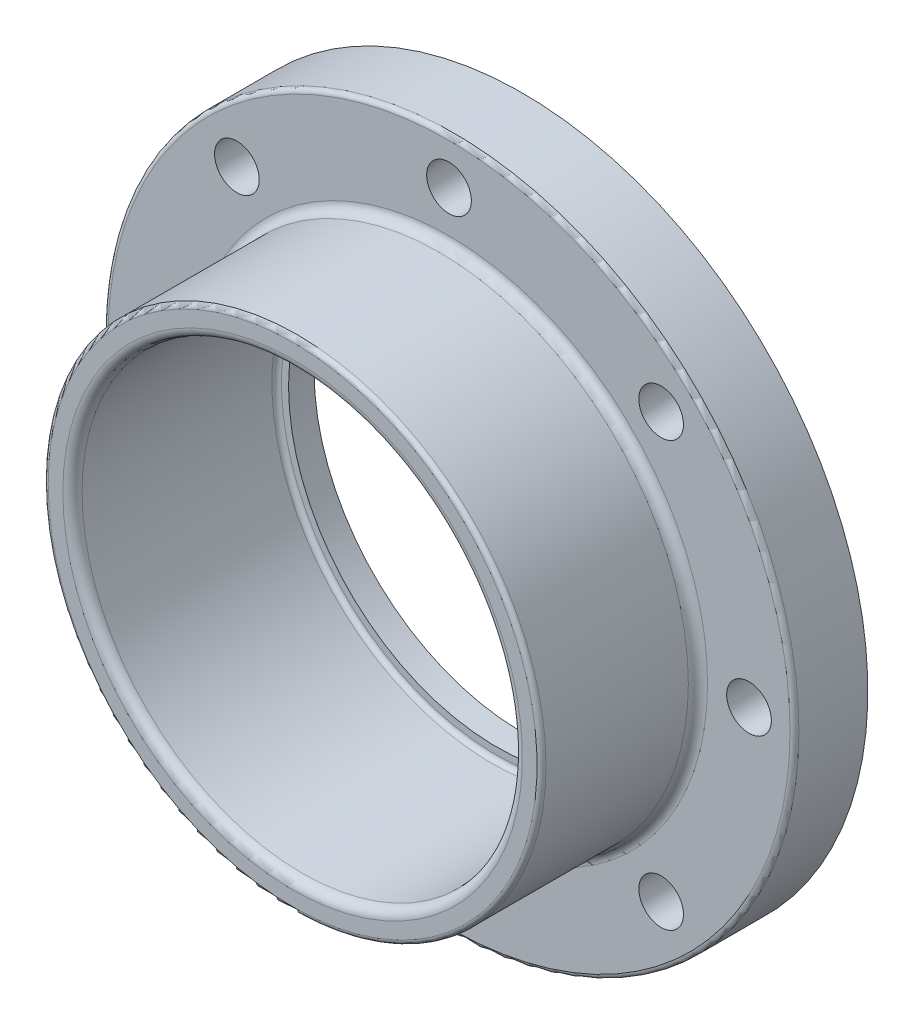
from build123d import *

# Parameters (mm, degrees)
SKETCH8_R                     = 171.846875
SKETCH8_R_2                   = 103.632
BOSS_EXTRUDE3_DEPTH           = 38.1
SKETCH4_R                     = 123.825
SKETCH4_R_2                   = 103.632
BOSS_EXTRUDE2_DEPTH           = 77.7875
SKETCH5_R                     = 109.5375
CUT_EXTRUDE1_DEPTH            = 101.6
FILLET1_R                     = 2.3876
SKETCH6_R                     = 11.1125
CUT_EXTRUDE2_DEPTH            = 256.173650777
CIRPATTERN1_COUNT             = 8
CUT_EXTRUDE3_DEPTH            = 20.6375
FILLET2_R                     = 2.2225
CIRPATTERN2_COUNT             = 8
FILLET2_OF_CIRPATTERN2_R      = 2.2225
FILLET3_R                     = 2.2225
FILLET4_R                     = 4.7752
SKETCH13_R                    = 171.846875
SKETCH13_R_2                  = 134.66445
CUT_EXTRUDE4_DEPTH            = 1.5875
SKETCH12_R                    = 13.6985375
SKETCH12_R_2                  = 11.9745125
BOSS_EXTRUDE4_DEPTH           = 1.5875
BOSS_EXTRUDE4_DRAFT           = 20
BOSS_EXTRUDE4_PROFILE_2_DEPTH = 1.5875
BOSS_EXTRUDE4_PROFILE_2_DRAFT = 20
BOSS_EXTRUDE4_PROFILE_3_DEPTH = 1.5875
BOSS_EXTRUDE4_PROFILE_3_DRAFT = 20
BOSS_EXTRUDE4_PROFILE_4_DEPTH = 1.5875
BOSS_EXTRUDE4_PROFILE_4_DRAFT = 20
BOSS_EXTRUDE4_PROFILE_5_DEPTH = 1.5875
BOSS_EXTRUDE4_PROFILE_5_DRAFT = 20
BOSS_EXTRUDE4_PROFILE_6_DEPTH = 1.5875
BOSS_EXTRUDE4_PROFILE_6_DRAFT = 20
BOSS_EXTRUDE4_PROFILE_7_DEPTH = 1.5875
BOSS_EXTRUDE4_PROFILE_7_DRAFT = 20
BOSS_EXTRUDE4_PROFILE_8_DEPTH = 1.5875
BOSS_EXTRUDE4_PROFILE_8_DRAFT = 20


with BuildPart() as part:
    # Sketch8 → Boss-Extrude3 (new body)
    with BuildSketch(Plane.XY):
        with Locations(Location((0, 0, 0), (0, 0, 180))):
            Circle(SKETCH8_R)
        with Locations(Location((0, 0, 0), (0, 0, 180))):
            Circle(SKETCH8_R_2, mode=Mode.SUBTRACT)
    extrude(amount=BOSS_EXTRUDE3_DEPTH)

    # Sketch4 → Boss-Extrude2 (add)
    with BuildSketch(Plane(origin=(0, 0, 38.1), x_dir=(-1, 0, 0), z_dir=(0, 0, -1))):
        Circle(SKETCH4_R)
        Circle(SKETCH4_R_2, mode=Mode.SUBTRACT)
    extrude(amount=-BOSS_EXTRUDE2_DEPTH)

    # Sketch5 → Cut-Extrude1 (cut)
    with BuildSketch(Plane.XY.offset(115.8875)):
        Circle(SKETCH5_R)
    extrude(amount=-CUT_EXTRUDE1_DEPTH, mode=Mode.SUBTRACT)

    # Fillet1
    fillet1_edges = [part.edges().sort_by_distance(p)[0] for p in [
        (-109.5375, 0, 14.2875),
    ]]
    fillet(fillet1_edges, radius=FILLET1_R)

    # Sketch6 → Cut-Extrude2 (cut, through all)
    with BuildSketch(Plane.XY.offset(38.1)):
        with Locations((0, 149.225)):
            Circle(SKETCH6_R)
    cut_extrude2 = extrude(amount=-CUT_EXTRUDE2_DEPTH, mode=Mode.SUBTRACT)

    # CirPattern1: Cut-Extrude2 ×8 about axis
    cirpattern1_axis = Axis((0, 0, 0), (0, 0, 1))
    for i in range(1, CIRPATTERN1_COUNT):
        add(cut_extrude2.rotate(cirpattern1_axis, i * 360 / CIRPATTERN1_COUNT), mode=Mode.SUBTRACT)

    # Sketch7 → Cut-Extrude3 (cut)
    with BuildSketch(Plane(origin=(0, 0, 0), x_dir=(-1, 0, 0), z_dir=(0, 0, -1))):
        with BuildLine():
            ThreePointArc((-49.547012336, 152.490024181), (-61.358504837, 148.132534544), (-72.791701752, 142.861758572))
            ThreePointArc((-72.791701752, 142.861758572), (-77.648042324, 127.915479144), (-62.701762895, 123.059138572))
            ThreePointArc((-62.701762895, 123.059138572), (-52.853365553, 127.599311934), (-42.679109636, 131.352793107))
            ThreePointArc((-42.679109636, 131.352793107), (-35.544445448, 145.355359994), (-49.547012336, 152.490024181))
        make_face()
    cut_extrude3 = extrude(amount=-CUT_EXTRUDE3_DEPTH, mode=Mode.SUBTRACT)

    # Fillet2
    fillet2_edges = [part.edges().sort_by_distance(p)[0] for p in [
        (35.544445448, 145.355359994, 20.6375),
        (52.853365553, 127.599311934, 20.6375),
        (77.648042324, 127.915479144, 20.6375),
        (61.358504837, 148.132534544, 20.6375),
    ]]
    fillet(fillet2_edges, radius=FILLET2_R)

    # CirPattern2: Cut-Extrude3 ×8 about axis
    cirpattern2_axis = Axis((0, 0, 0), (0, 0, 1))
    for i in range(1, CIRPATTERN2_COUNT):
        add(cut_extrude3.rotate(cirpattern2_axis, i * 360 / CIRPATTERN2_COUNT), mode=Mode.SUBTRACT)

    # Fillet2 of CirPattern2
    fillet2_of_cirpattern2_edges = [part.edges().sort_by_distance(p)[0] for p in [
        (-77.648042324, 127.915479144, 20.6375),
        (-52.853365553, 127.599311934, 20.6375),
        (-35.544445448, 145.355359994, 20.6375),
        (-61.358504837, 148.132534544, 20.6375),
        (-145.355359994, 35.544445448, 20.6375),
        (-127.599311934, 52.853365553, 20.6375),
        (-127.915479144, 77.648042324, 20.6375),
        (-148.132534544, 61.358504837, 20.6375),
        (-127.915479144, -77.648042324, 20.6375),
        (-127.599311934, -52.853365553, 20.6375),
        (-145.355359994, -35.544445448, 20.6375),
        (-148.132534544, -61.358504837, 20.6375),
        (-35.544445448, -145.355359994, 20.6375),
        (-52.853365553, -127.599311934, 20.6375),
        (-77.648042324, -127.915479144, 20.6375),
        (-61.358504837, -148.132534544, 20.6375),
        (77.648042324, -127.915479144, 20.6375),
        (52.853365553, -127.599311934, 20.6375),
        (35.544445448, -145.355359994, 20.6375),
        (61.358504837, -148.132534544, 20.6375),
        (145.355359994, -35.544445448, 20.6375),
        (127.599311934, -52.853365553, 20.6375),
        (127.915479144, -77.648042324, 20.6375),
        (148.132534544, -61.358504837, 20.6375),
        (127.915479144, 77.648042324, 20.6375),
        (127.599311934, 52.853365553, 20.6375),
        (145.355359994, 35.544445448, 20.6375),
        (148.132534544, 61.358504837, 20.6375),
    ]]
    fillet(fillet2_of_cirpattern2_edges, radius=FILLET2_OF_CIRPATTERN2_R)

    # Fillet3
    fillet3_edges = [part.edges().sort_by_distance(p)[0] for p in [
        (123.825, 0, 115.8875),
        (171.846875, 0, 38.1),
    ]]
    fillet(fillet3_edges, radius=FILLET3_R)

    # Fillet4
    fillet4_edges = [part.edges().sort_by_distance(p)[0] for p in [
        (-109.5375, 0, 115.8875),
        (123.825, 0, 38.1),
    ]]
    fillet(fillet4_edges, radius=FILLET4_R)

    # Sketch10 → Cut-Revolve1 (revolve, cut)
    with BuildSketch(Plane(origin=(0, 0, 0), x_dir=(0, 0, -1), z_dir=(1, 0, 0))):
        Polygon((-1.5875, 134.66445), (1.86055, 134.66445), (1.86055, 103.632), (-1.5875, 103.632), (-1.5875, 110.5281), (0, 113.97615), (0, 131.2164), align=None)
    revolve(axis=Axis((0, 0, 0), (0, 0, 1)), mode=Mode.SUBTRACT)

    # Sketch13 → Cut-Extrude4 (cut)
    with BuildSketch(Plane(origin=(0, 0, 0), x_dir=(-1, 0, 0), z_dir=(0, 0, -1))):
        Circle(SKETCH13_R)
        Circle(SKETCH13_R_2, mode=Mode.SUBTRACT)
    extrude(amount=-CUT_EXTRUDE4_DEPTH, mode=Mode.SUBTRACT)


with BuildPart() as boss_extrude4_tool:
    # Sketch12 → Boss-Extrude4 (with draft: the straight prism first)
    with BuildSketch(Plane(origin=(0, 0, 1.5875), x_dir=(-1, 0, 0), z_dir=(0, 0, -1))):
        with Locations((0, 149.225)):
            Circle(SKETCH12_R)
        with Locations((0, 149.225)):
            Circle(SKETCH12_R_2, mode=Mode.SUBTRACT)
    extrude(amount=BOSS_EXTRUDE4_DEPTH)
    # Boss-Extrude4: the draft: its side faces are tilted about the plane it starts from
    boss_extrude4_sides = [boss_extrude4_tool.faces().sort_by_distance(p)[0] for p in [
        (13.6985375, 149.225, 0.79375),
        (11.9745125, 149.225, 0.79375),
    ]]
    draft(boss_extrude4_sides, Plane(origin=(0, 0, 1.5875), x_dir=(-1, 0, 0), z_dir=(0, 0, -1)), BOSS_EXTRUDE4_DRAFT)


with BuildPart() as part_1:
    add(part.part)

    # Boss-Extrude4: add boss_extrude4_tool
    add(boss_extrude4_tool.part)


with BuildPart() as boss_extrude4_profile_2_tool:
    # Sketch12 → Boss-Extrude4 profile 2 (with draft: the straight prism first)
    with BuildSketch(Plane(origin=(0, 0, 1.5875), x_dir=(-1, 0, 0), z_dir=(0, 0, -1))):
        with Locations((-105.518009423, 105.518009423)):
            Circle(SKETCH12_R)
        with Locations((-105.518009423, 105.518009423)):
            Circle(SKETCH12_R_2, mode=Mode.SUBTRACT)
    extrude(amount=BOSS_EXTRUDE4_PROFILE_2_DEPTH)
    # Boss-Extrude4 profile 2: the draft: its side faces are tilted about the plane it starts from
    boss_extrude4_profile_2_sides = [boss_extrude4_profile_2_tool.faces().sort_by_distance(p)[0] for p in [
        (119.216546923, 105.518009423, 0.79375),
        (117.492521923, 105.518009423, 0.79375),
    ]]
    draft(boss_extrude4_profile_2_sides, Plane(origin=(0, 0, 1.5875), x_dir=(-1, 0, 0), z_dir=(0, 0, -1)), BOSS_EXTRUDE4_PROFILE_2_DRAFT)


with BuildPart() as part_2:
    add(part_1.part)

    # Boss-Extrude4 profile 2: add boss_extrude4_profile_2_tool
    add(boss_extrude4_profile_2_tool.part)


with BuildPart() as boss_extrude4_profile_3_tool:
    # Sketch12 → Boss-Extrude4 profile 3 (with draft: the straight prism first)
    with BuildSketch(Plane(origin=(0, 0, 1.5875), x_dir=(-1, 0, 0), z_dir=(0, 0, -1))):
        with Locations((-149.225, 0)):
            Circle(SKETCH12_R)
        with Locations((-149.225, 0)):
            Circle(SKETCH12_R_2, mode=Mode.SUBTRACT)
    extrude(amount=BOSS_EXTRUDE4_PROFILE_3_DEPTH)
    # Boss-Extrude4 profile 3: the draft: its side faces are tilted about the plane it starts from
    boss_extrude4_profile_3_sides = [boss_extrude4_profile_3_tool.faces().sort_by_distance(p)[0] for p in [
        (162.9235375, 0, 0.79375),
        (161.1995125, 0, 0.79375),
    ]]
    draft(boss_extrude4_profile_3_sides, Plane(origin=(0, 0, 1.5875), x_dir=(-1, 0, 0), z_dir=(0, 0, -1)), BOSS_EXTRUDE4_PROFILE_3_DRAFT)


with BuildPart() as part_3:
    add(part_2.part)

    # Boss-Extrude4 profile 3: add boss_extrude4_profile_3_tool
    add(boss_extrude4_profile_3_tool.part)


with BuildPart() as boss_extrude4_profile_4_tool:
    # Sketch12 → Boss-Extrude4 profile 4 (with draft: the straight prism first)
    with BuildSketch(Plane(origin=(0, 0, 1.5875), x_dir=(-1, 0, 0), z_dir=(0, 0, -1))):
        with Locations((-105.518009423, -105.518009423)):
            Circle(SKETCH12_R)
        with Locations((-105.518009423, -105.518009423)):
            Circle(SKETCH12_R_2, mode=Mode.SUBTRACT)
    extrude(amount=BOSS_EXTRUDE4_PROFILE_4_DEPTH)
    # Boss-Extrude4 profile 4: the draft: its side faces are tilted about the plane it starts from
    boss_extrude4_profile_4_sides = [boss_extrude4_profile_4_tool.faces().sort_by_distance(p)[0] for p in [
        (119.216546923, -105.518009423, 0.79375),
        (117.492521923, -105.518009423, 0.79375),
    ]]
    draft(boss_extrude4_profile_4_sides, Plane(origin=(0, 0, 1.5875), x_dir=(-1, 0, 0), z_dir=(0, 0, -1)), BOSS_EXTRUDE4_PROFILE_4_DRAFT)


with BuildPart() as part_4:
    add(part_3.part)

    # Boss-Extrude4 profile 4: add boss_extrude4_profile_4_tool
    add(boss_extrude4_profile_4_tool.part)


with BuildPart() as boss_extrude4_profile_5_tool:
    # Sketch12 → Boss-Extrude4 profile 5 (with draft: the straight prism first)
    with BuildSketch(Plane(origin=(0, 0, 1.5875), x_dir=(-1, 0, 0), z_dir=(0, 0, -1))):
        with Locations((0, -149.225)):
            Circle(SKETCH12_R)
        with Locations((0, -149.225)):
            Circle(SKETCH12_R_2, mode=Mode.SUBTRACT)
    extrude(amount=BOSS_EXTRUDE4_PROFILE_5_DEPTH)
    # Boss-Extrude4 profile 5: the draft: its side faces are tilted about the plane it starts from
    boss_extrude4_profile_5_sides = [boss_extrude4_profile_5_tool.faces().sort_by_distance(p)[0] for p in [
        (13.6985375, -149.225, 0.79375),
        (11.9745125, -149.225, 0.79375),
    ]]
    draft(boss_extrude4_profile_5_sides, Plane(origin=(0, 0, 1.5875), x_dir=(-1, 0, 0), z_dir=(0, 0, -1)), BOSS_EXTRUDE4_PROFILE_5_DRAFT)


with BuildPart() as part_5:
    add(part_4.part)

    # Boss-Extrude4 profile 5: add boss_extrude4_profile_5_tool
    add(boss_extrude4_profile_5_tool.part)


with BuildPart() as boss_extrude4_profile_6_tool:
    # Sketch12 → Boss-Extrude4 profile 6 (with draft: the straight prism first)
    with BuildSketch(Plane(origin=(0, 0, 1.5875), x_dir=(-1, 0, 0), z_dir=(0, 0, -1))):
        with Locations((105.518009423, -105.518009423)):
            Circle(SKETCH12_R)
        with Locations((105.518009423, -105.518009423)):
            Circle(SKETCH12_R_2, mode=Mode.SUBTRACT)
    extrude(amount=BOSS_EXTRUDE4_PROFILE_6_DEPTH)
    # Boss-Extrude4 profile 6: the draft: its side faces are tilted about the plane it starts from
    boss_extrude4_profile_6_sides = [boss_extrude4_profile_6_tool.faces().sort_by_distance(p)[0] for p in [
        (-91.819471923, -105.518009423, 0.79375),
        (-93.543496923, -105.518009423, 0.79375),
    ]]
    draft(boss_extrude4_profile_6_sides, Plane(origin=(0, 0, 1.5875), x_dir=(-1, 0, 0), z_dir=(0, 0, -1)), BOSS_EXTRUDE4_PROFILE_6_DRAFT)


with BuildPart() as part_6:
    add(part_5.part)

    # Boss-Extrude4 profile 6: add boss_extrude4_profile_6_tool
    add(boss_extrude4_profile_6_tool.part)


with BuildPart() as boss_extrude4_profile_7_tool:
    # Sketch12 → Boss-Extrude4 profile 7 (with draft: the straight prism first)
    with BuildSketch(Plane(origin=(0, 0, 1.5875), x_dir=(-1, 0, 0), z_dir=(0, 0, -1))):
        with Locations((149.225, 0)):
            Circle(SKETCH12_R)
        with Locations((149.225, 0)):
            Circle(SKETCH12_R_2, mode=Mode.SUBTRACT)
    extrude(amount=BOSS_EXTRUDE4_PROFILE_7_DEPTH)
    # Boss-Extrude4 profile 7: the draft: its side faces are tilted about the plane it starts from
    boss_extrude4_profile_7_sides = [boss_extrude4_profile_7_tool.faces().sort_by_distance(p)[0] for p in [
        (-135.5264625, 0, 0.79375),
        (-137.2504875, 0, 0.79375),
    ]]
    draft(boss_extrude4_profile_7_sides, Plane(origin=(0, 0, 1.5875), x_dir=(-1, 0, 0), z_dir=(0, 0, -1)), BOSS_EXTRUDE4_PROFILE_7_DRAFT)


with BuildPart() as part_7:
    add(part_6.part)

    # Boss-Extrude4 profile 7: add boss_extrude4_profile_7_tool
    add(boss_extrude4_profile_7_tool.part)


with BuildPart() as boss_extrude4_profile_8_tool:
    # Sketch12 → Boss-Extrude4 profile 8 (with draft: the straight prism first)
    with BuildSketch(Plane(origin=(0, 0, 1.5875), x_dir=(-1, 0, 0), z_dir=(0, 0, -1))):
        with Locations((105.518009423, 105.518009423)):
            Circle(SKETCH12_R)
        with Locations((105.518009423, 105.518009423)):
            Circle(SKETCH12_R_2, mode=Mode.SUBTRACT)
    extrude(amount=BOSS_EXTRUDE4_PROFILE_8_DEPTH)
    # Boss-Extrude4 profile 8: the draft: its side faces are tilted about the plane it starts from
    boss_extrude4_profile_8_sides = [boss_extrude4_profile_8_tool.faces().sort_by_distance(p)[0] for p in [
        (-91.819471923, 105.518009423, 0.79375),
        (-93.543496923, 105.518009423, 0.79375),
    ]]
    draft(boss_extrude4_profile_8_sides, Plane(origin=(0, 0, 1.5875), x_dir=(-1, 0, 0), z_dir=(0, 0, -1)), BOSS_EXTRUDE4_PROFILE_8_DRAFT)


with BuildPart() as part_8:
    add(part_7.part)

    # Boss-Extrude4 profile 8: add boss_extrude4_profile_8_tool
    add(boss_extrude4_profile_8_tool.part)


solid = part_8.part
